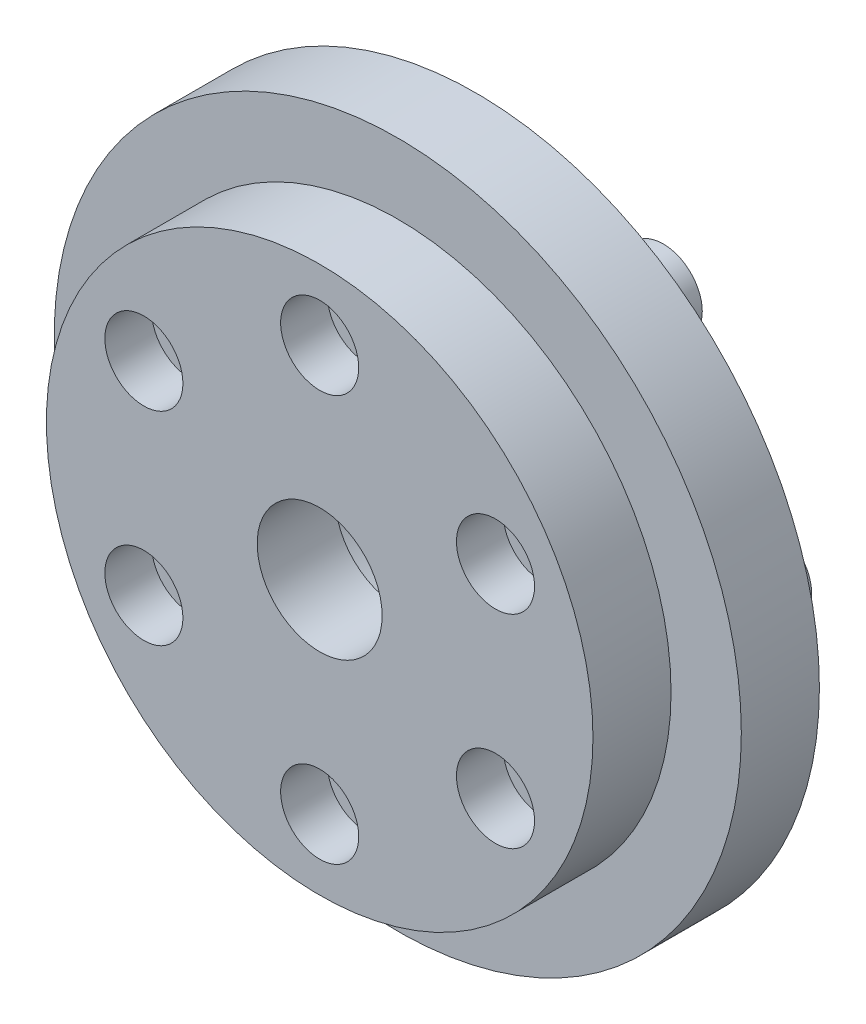
from build123d import *

# Parameters (mm, degrees)
SKETCH2_R             = 2.5
BOSS_EXTRUDE1_DEPTH   = 5
BOSS_EXTRUDE1_2_DEPTH = 5
BOSS_EXTRUDE1_3_DEPTH = 5
BOSS_EXTRUDE1_4_DEPTH = 5
BOSS_EXTRUDE1_5_DEPTH = 5
BOSS_EXTRUDE1_6_DEPTH = 5
SKETCH3_R             = 22
BOSS_EXTRUDE2_DEPTH   = 5
SKETCH4_R             = 17.5
BOSS_EXTRUDE3_DEPTH   = 5
SKETCH5_R             = 8
CUT_EXTRUDE1_DEPTH    = 10
SKETCH11_R            = 2.5
CUT_EXTRUDE4_DEPTH    = 3
SKETCH13_R            = 8
SKETCH13_R_2          = 4
BOSS_EXTRUDE5_DEPTH   = 5


with BuildPart() as part:
    # Sketch2 → Boss-Extrude1 (new body)
    with BuildSketch(Plane.XY):
        with Locations((-7, 12.124355653)):
            Circle(SKETCH2_R)
    extrude(amount=BOSS_EXTRUDE1_DEPTH)



with BuildPart() as body_2:
    # Sketch2 → Boss-Extrude1 2 (new body)
    with BuildSketch(Plane.XY):
        with Locations((7, 12.124355653)):
            Circle(SKETCH2_R)
    extrude(amount=BOSS_EXTRUDE1_2_DEPTH)


with BuildPart() as body_3:
    # Sketch2 → Boss-Extrude1 3 (new body)
    with BuildSketch(Plane.XY):
        with Locations((14, 0)):
            Circle(SKETCH2_R)
    extrude(amount=BOSS_EXTRUDE1_3_DEPTH)


with BuildPart() as body_4:
    # Sketch2 → Boss-Extrude1 4 (new body)
    with BuildSketch(Plane.XY):
        with Locations((7, -12.124355653)):
            Circle(SKETCH2_R)
    extrude(amount=BOSS_EXTRUDE1_4_DEPTH)


with BuildPart() as body_5:
    # Sketch2 → Boss-Extrude1 5 (new body)
    with BuildSketch(Plane.XY):
        with Locations((-7, -12.124355653)):
            Circle(SKETCH2_R)
    extrude(amount=BOSS_EXTRUDE1_5_DEPTH)


with BuildPart() as body_6:
    # Sketch2 → Boss-Extrude1 6 (new body)
    with BuildSketch(Plane.XY):
        with Locations((-14, 0)):
            Circle(SKETCH2_R)
    extrude(amount=BOSS_EXTRUDE1_6_DEPTH)


with BuildPart() as part_1:
    add(part.part)

    add(body_2.part)  # Boss-Extrude2 merges body 2

    add(body_3.part)  # Boss-Extrude2 merges body 3

    add(body_4.part)  # Boss-Extrude2 merges body 4

    add(body_5.part)  # Boss-Extrude2 merges body 5

    add(body_6.part)  # Boss-Extrude2 merges body 6
    # Sketch3 → Boss-Extrude2 (add)
    with BuildSketch(Plane.XY.offset(5)):
        Circle(SKETCH3_R)
    extrude(amount=BOSS_EXTRUDE2_DEPTH)

    # Sketch4 → Boss-Extrude3 (add)
    with BuildSketch(Plane.XY.offset(10)):
        Circle(SKETCH4_R)
    extrude(amount=BOSS_EXTRUDE3_DEPTH)

    # Sketch5 → Cut-Extrude1 (cut)
    with BuildSketch(Plane.XY.offset(15)):
        Circle(SKETCH5_R)
    extrude(amount=-CUT_EXTRUDE1_DEPTH, mode=Mode.SUBTRACT)

    # Sketch11 → Cut-Extrude4 (cut)
    with BuildSketch(Plane.XY.offset(15)):
        with Locations((0, 13)):
            Circle(SKETCH11_R)
        with Locations((11.258330249, 6.5)):
            Circle(SKETCH11_R)
        with Locations((11.258330249, -6.5)):
            Circle(SKETCH11_R)
        with Locations((0, -13)):
            Circle(SKETCH11_R)
        with Locations((-11.258330249, -6.5)):
            Circle(SKETCH11_R)
        with Locations((-11.258330249, 6.5)):
            Circle(SKETCH11_R)
    extrude(amount=-CUT_EXTRUDE4_DEPTH, mode=Mode.SUBTRACT)

    # Sketch13 → Boss-Extrude5 (add)
    with BuildSketch(Plane.XY.offset(15)):
        Circle(SKETCH13_R)
        Circle(SKETCH13_R_2, mode=Mode.SUBTRACT)
    extrude(amount=-BOSS_EXTRUDE5_DEPTH)


solid = part_1.part
